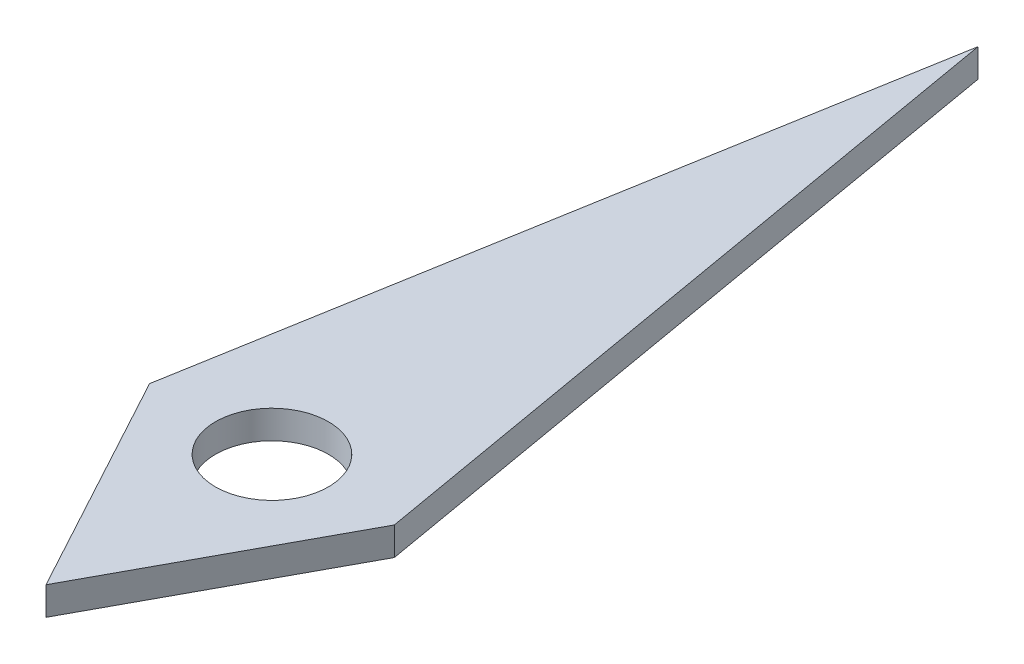
from build123d import *

# Parameters (mm, degrees)
BOSS_EXTRUDE1_DEPTH = 0.3
SKETCH3_R           = 0.6
CUT_EXTRUDE1_DEPTH  = 0.3


with BuildPart() as part:
    # Sketch2 → Boss-Extrude1 (new body)
    with BuildSketch(Plane(origin=(0, 0, 0), x_dir=(1, 0, 0), z_dir=(0, 1, 0))):
        Polygon((-1.3, 0), (0, 7.5), (1.3, 0), (0, -2.4), align=None)
    extrude(amount=BOSS_EXTRUDE1_DEPTH)

    # Sketch3 → Cut-Extrude1 (cut)
    with BuildSketch(Plane(origin=(0, 0.3, 0), x_dir=(1, 0, 0), z_dir=(0, 1, 0))):
        with Locations(Location((0, 0, 0), (0, 0, 270))):
            Circle(SKETCH3_R)
    extrude(amount=-CUT_EXTRUDE1_DEPTH, mode=Mode.SUBTRACT)


solid = part.part
